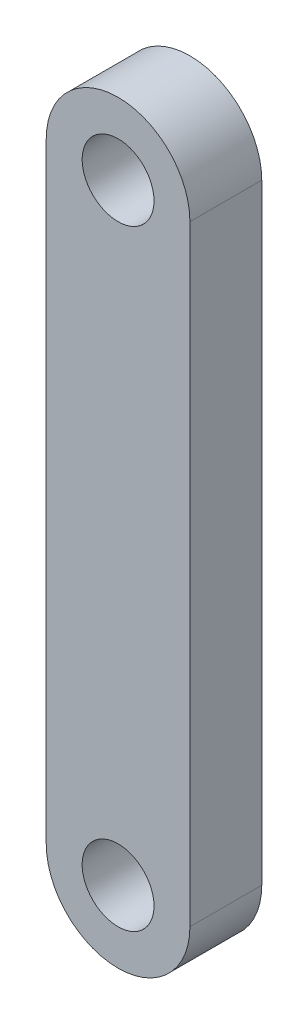
from build123d import *

# Parameters (mm, degrees)
CROQUIS1_R              = 1
SALIENTE_EXTRUIR1_DEPTH = 2


with BuildPart() as part:
    # Croquis1 → Saliente-Extruir1 (new body)
    with BuildSketch(Plane.XY):
        with BuildLine():
            Line((0, 0), (0, -17))
            ThreePointArc((0, -17), (2, -19), (4, -17))
            Line((4, -17), (4, 0))
            ThreePointArc((4, 0), (2, 2), (0, 0))
        make_face()
        with Locations((2, 0)):
            Circle(CROQUIS1_R, mode=Mode.SUBTRACT)
        with Locations((2, -17)):
            Circle(CROQUIS1_R, mode=Mode.SUBTRACT)
    extrude(amount=SALIENTE_EXTRUIR1_DEPTH)


solid = part.part
